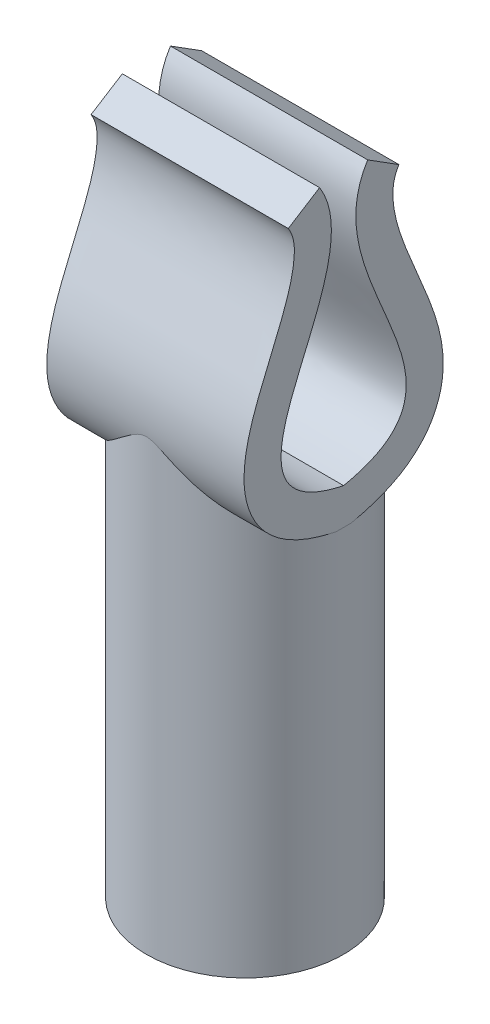
from build123d import *

# Parameters (mm, degrees)
SKETCH2_W           = 4.8
SKETCH2_H           = 4.8
BOSS_EXTRUDE1_DEPTH = 10
BOSS_EXTRUDE2_DEPTH = 4
CUT_EXTRUDE2_DEPTH  = 13
CHAMFER2_SIZE       = 1
CUT_EXTRUDE3_DEPTH  = 10
BOSS_EXTRUDE4_REACH = 30.006
SKETCH8_R           = 4
SKETCH9_R           = 3.15
CUT_EXTRUDE4_DEPTH  = 3


with BuildPart() as part:
    # Sketch2 → Boss-Extrude1 (new body)
    with BuildSketch(Plane(origin=(0, 0, 0), x_dir=(1, 0, 0), z_dir=(0, 1, 0))):
        Rectangle(SKETCH2_W, SKETCH2_H)
    extrude(amount=BOSS_EXTRUDE1_DEPTH)

    # Sketch3 → Boss-Extrude2 (add, symmetric)
    with BuildSketch(Plane(origin=(0, 0, 0), x_dir=(0, 0, -1), z_dir=(1, 0, 0))):
        with BuildLine():
            Line((0.975338076, 19.454930534), (2.244202659, 18.654941366))
            add(Edge.make_bspline(
                [(0.30648988, 7.031645835), (0.529978824, 7.07829473), (0.984294969, 7.190115645), (1.788597583, 7.465388749), (2.682183374, 7.937701579), (3.530088414, 8.792890438), (3.993751964, 9.86950816), (4.073268982, 10.920061697), (3.885357462, 12.187039531), (3.360108624, 13.61802638), (2.635999183, 15.252362125), (2.079934075, 16.758846516), (1.937481109, 17.932951534), (2.096258838, 18.420287345), (2.244202659, 18.654941366)],
                knots=[0, 0, 0, 0, 0.03125, 0.0625, 0.125, 0.1875, 0.25, 0.3125, 0.375, 0.5, 0.625, 0.75, 0.875, 1, 1, 1, 1], degree=3))
            Line((0.30648988, 7.031645835), (0, 7.031645835))
            Line((0, 7.031645835), (0, 8.5))
            add(Edge.make_bspline(
                [(0, 8.5), (6.305568428, 9.816162649), (-1.423122637, 15.650726713), (0.975338076, 19.454930534)],
                knots=[0, 0, 0, 0, 1, 1, 1, 1], degree=3))
        make_face()
    boss_extrude2 = extrude(amount=BOSS_EXTRUDE2_DEPTH, both=True)

    # Mirror2: Boss-Extrude2 across plane
    add(boss_extrude2.mirror(Plane.XY))

    # Sketch4 → Cut-Extrude2 (cut)
    with BuildSketch(Plane.ZY.offset(4)):
        with BuildLine():
            Line((2.4, 10), (-2.4, 10))
            add(Edge.make_bspline(
                [(0, 8.5), (-1.418719804, 8.796129689), (-2.126988365, 9.320992778), (-2.4, 10)],
                knots=[0.775005248, 0.775005248, 0.775005248, 0.775005248, 1, 1, 1, 1], degree=3))
            add(Edge.make_bspline(
                [(2.4, 10), (2.126988365, 9.320992778), (1.418719804, 8.796129689), (0, 8.5)],
                knots=[0.775005248, 0.775005248, 0.775005248, 0.775005248, 1, 1, 1, 1], degree=3))
        make_face()
    extrude(amount=-CUT_EXTRUDE2_DEPTH, mode=Mode.SUBTRACT)

    # Chamfer2
    chamfer2_edges = [part.edges().sort_by_distance(p)[0] for p in [
        (0, 0, 2.4),
        (-2.4, 0, 0),
        (0, 0, -2.4),
        (2.4, 0, 0),
    ]]
    chamfer(chamfer2_edges, length=CHAMFER2_SIZE)

    # Sketch7 → Cut-Extrude3 (cut)
    with BuildSketch(Plane(origin=(4, 0, 0), x_dir=(0, 0, -1), z_dir=(1, 0, 0))):
        with BuildLine():
            Line((-0.30648988, 7.031645835), (0.30648988, 7.031645835))
            add(Edge.make_bspline(
                [(0.30648988, 7.031645835), (0.529978824, 7.07829473), (0.984294969, 7.190115645), (1.688906484, 7.431269404), (2.145705095, 7.657210623), (2.4, 7.818172285)],
                knots=[0, 0, 0, 0, 0.03125, 0.0625, 0.109506593, 0.109506593, 0.109506593, 0.109506593], degree=3))
            Line((2.4, 7.818172285), (2.4, 0))
            Line((2.4, 0), (-2.4, 0))
            Line((-2.4, 0), (-2.4, 7.818172285))
            add(Edge.make_bspline(
                [(-0.30648988, 7.031645835), (-0.529978824, 7.07829473), (-0.984294969, 7.190115645), (-1.688906484, 7.431269404), (-2.145705095, 7.657210623), (-2.4, 7.818172285)],
                knots=[0, 0, 0, 0, 0.03125, 0.0625, 0.109506593, 0.109506593, 0.109506593, 0.109506593], degree=3))
        make_face()
    extrude(amount=-CUT_EXTRUDE3_DEPTH, mode=Mode.SUBTRACT)

    # Sketch8 → Boss-Extrude4 (add, up to next)
    with BuildSketch(Plane(origin=(0, -7.968354165, 0), x_dir=(-1, 0, 0), z_dir=(0, -1, 0)), mode=Mode.PRIVATE) as boss_extrude4_sk1:
        with Locations(Location((0, 0, 0), (0, 0, 90))):
            Circle(SKETCH8_R)
    boss_extrude4_tool1 = extrude(boss_extrude4_sk1.sketch, amount=-BOSS_EXTRUDE4_REACH, mode=Mode.PRIVATE) - part.part
    add(boss_extrude4_tool1.solids().sort_by_distance((0, -7.968354, 0))[0])

    # Sketch9 → Cut-Extrude4 (cut)
    with BuildSketch(Plane.XZ.offset(7.968354165)):
        with Locations(Location((0, 0, 0), (0, 0, 270))):
            Circle(SKETCH9_R)
    extrude(amount=-CUT_EXTRUDE4_DEPTH, mode=Mode.SUBTRACT)


solid = part.part
